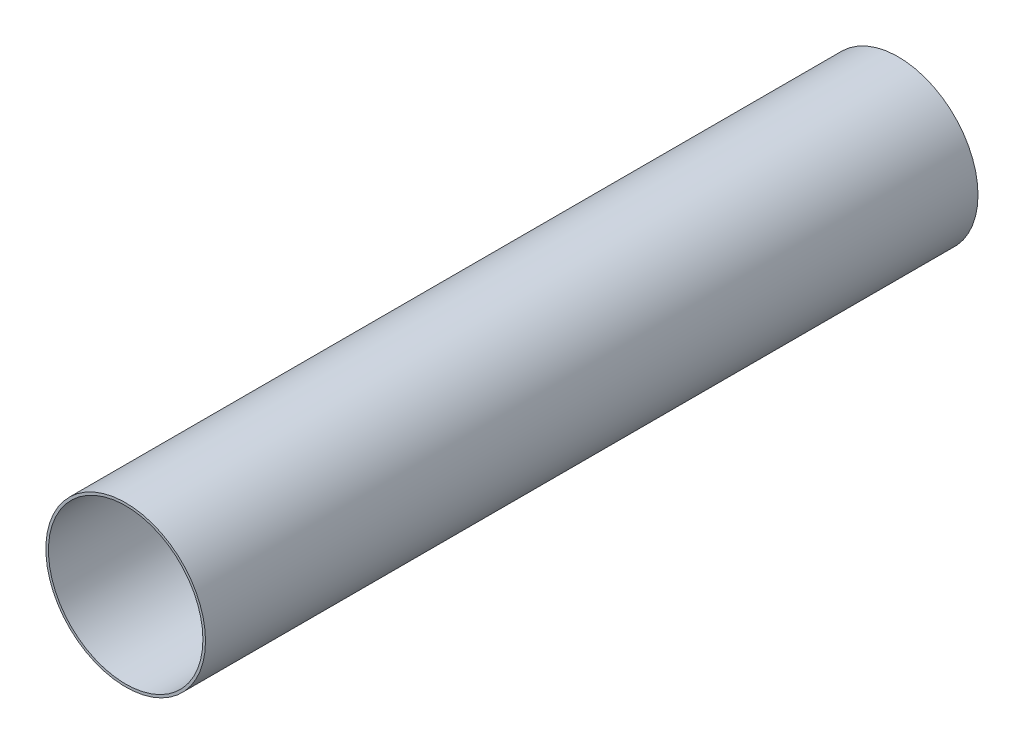
from build123d import *

# Parameters (mm, degrees)
CROQUIS1_R              = 155
CROQUIS1_R_2            = 150
SALIENTE_EXTRUIR1_DEPTH = 1500


with BuildPart() as part:
    # Croquis1 → Saliente-Extruir1 (new body)
    with BuildSketch(Plane(origin=(0, 0, 0), x_dir=(0, 1, 0), z_dir=(0, 0, 1))):
        with Locations(Location((0, 0, 0), (0, 0, 270))):
            Circle(CROQUIS1_R)
        with Locations(Location((0, 0, 0), (0, 0, 270))):
            Circle(CROQUIS1_R_2, mode=Mode.SUBTRACT)
    extrude(amount=SALIENTE_EXTRUIR1_DEPTH)


solid = part.part
